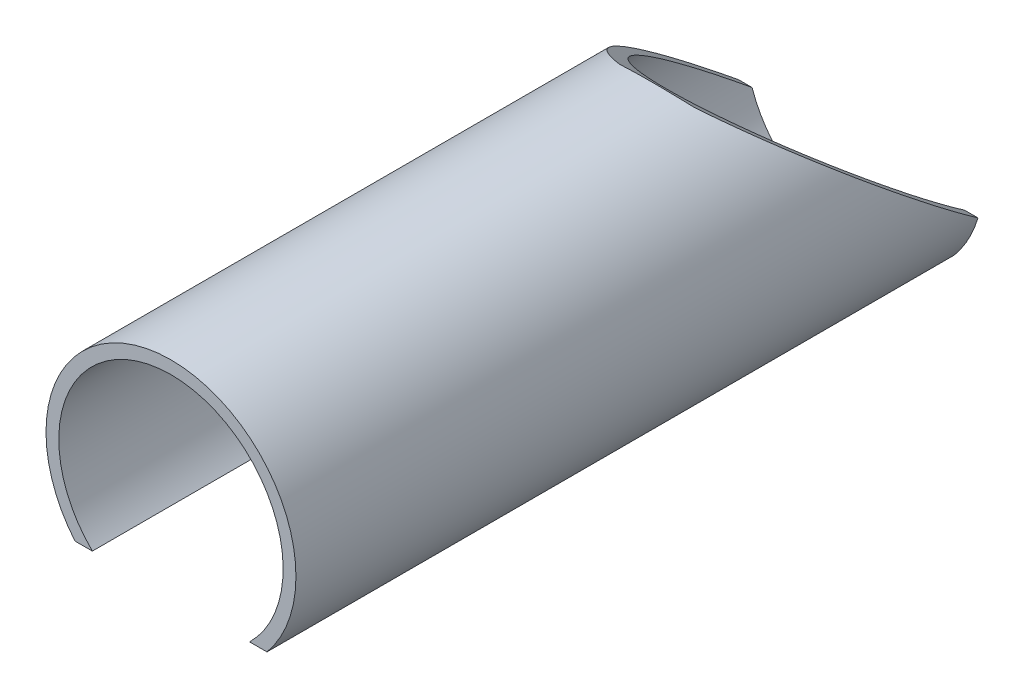
from build123d import *

# Parameters (mm, degrees)
SKETCH1_R               = 16
BOSS_EXTRUDE1_DEPTH     = 88
SKETCH2_R               = 14.360467733
CUT_EXTRUDE1_DEPTH      = 88
SKETCH3_W               = 41.504964389
SKETCH3_H               = 7.516490838
CUT_EXTRUDE2_DEPTH      = 88
CUT_EXTRUDE3_DEPTH      = 91.862533533
CUT_EXTRUDE3_DEPTH_BACK = 91.862533533


with BuildPart() as part:
    # Sketch1 → Boss-Extrude1 (new body)
    with BuildSketch(Plane.XY):
        Circle(SKETCH1_R)
    extrude(amount=BOSS_EXTRUDE1_DEPTH)

    # Sketch2 → Cut-Extrude1 (cut)
    with BuildSketch(Plane.XY.offset(88)):
        Circle(SKETCH2_R)
    extrude(amount=-CUT_EXTRUDE1_DEPTH, mode=Mode.SUBTRACT)

    # Sketch3 → Cut-Extrude2 (cut)
    with BuildSketch(Plane.XY.offset(88)):
        with Locations((1.087364542, -14.00175825)):
            Rectangle(SKETCH3_W, SKETCH3_H)
    extrude(amount=-CUT_EXTRUDE2_DEPTH, mode=Mode.SUBTRACT)

    # Sketch4 → Cut-Extrude3 (cut, two sides: drawn at the far end of the back side and taken through both)
    with BuildSketch(Plane(origin=(0, 0, 0), x_dir=(0, 0, -1), z_dir=(1, 0, 0)).offset(-CUT_EXTRUDE3_DEPTH_BACK)):
        Polygon((9.063254849, -11.588963216), (-25.804371383, 15.282726161), (-30.207370546, 20.432915897), (5.089153987, 19.311664184), align=None)
    extrude(amount=CUT_EXTRUDE3_DEPTH + CUT_EXTRUDE3_DEPTH_BACK, mode=Mode.SUBTRACT)


solid = part.part
